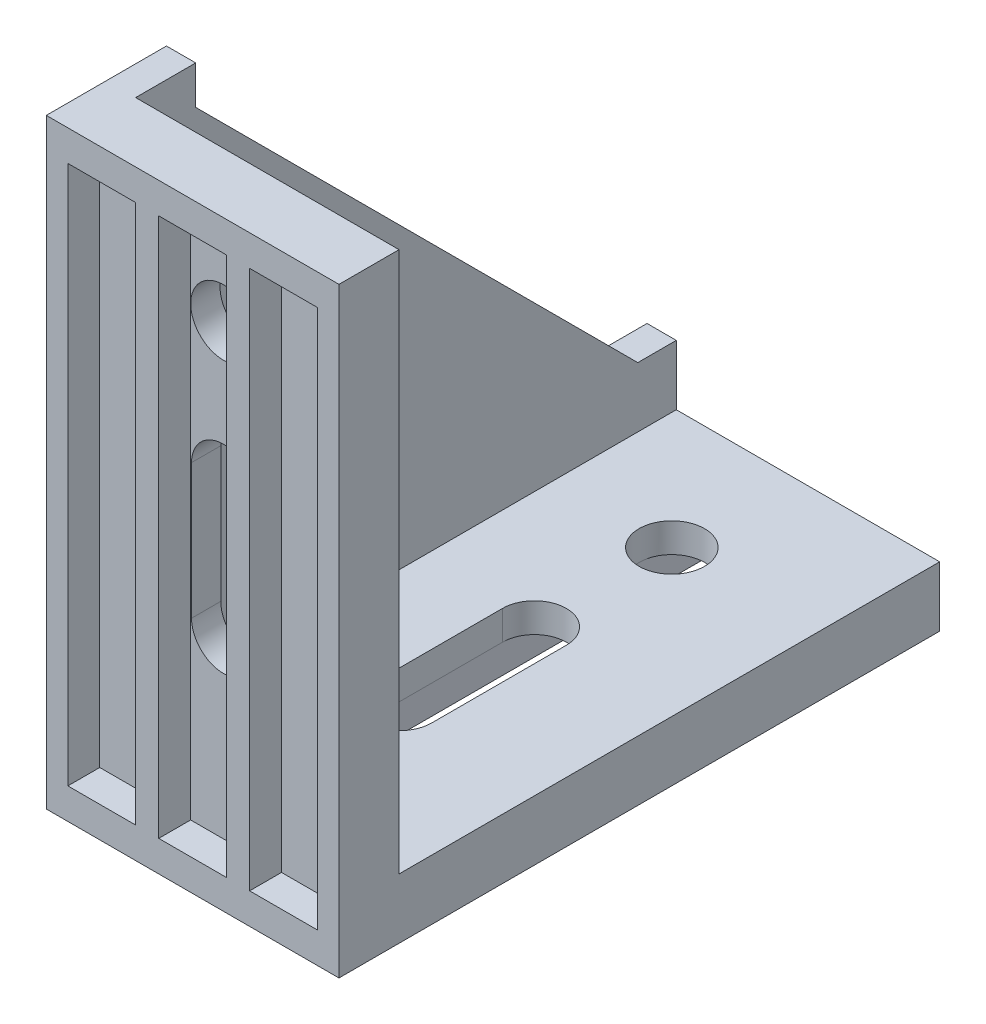
from build123d import *

# Parameters (mm, degrees)
SKETCH_1_W                    = 38
SKETCH_1_H                    = 78
EXTRUDE_1_DEPTH               = 7.8
SKETCH_3_W                    = 38
SKETCH_3_H                    = 7.8
EXTRUDE_2_DEPTH               = 78
EXTRUDE_3_DEPTH               = 3.8
SKETCH_5_R                    = 4.25
CUT_EXTRUDE_1_DEPTH           = 102.079572615
SKETCH_6_W                    = 8.8
SKETCH_6_H                    = 70
CUT_EXTRUDE_2_DEPTH           = 4
CUT_EXTRUDE_2_DRAFT           = -2
CUT_EXTRUDE_2_PROFILE_2_DEPTH = 4
CUT_EXTRUDE_2_PROFILE_2_DRAFT = -2
CUT_EXTRUDE_2_PROFILE_3_DEPTH = 4
CUT_EXTRUDE_2_PROFILE_3_DRAFT = -2
SKETCH_7_W                    = 8.8
SKETCH_7_H                    = 70
CUT_EXTRUDE_3_DEPTH           = 4
CUT_EXTRUDE_3_DRAFT           = -2
CUT_EXTRUDE_3_PROFILE_2_DEPTH = 4
CUT_EXTRUDE_3_PROFILE_2_DRAFT = -2
CUT_EXTRUDE_3_PROFILE_3_DEPTH = 4
CUT_EXTRUDE_3_PROFILE_3_DRAFT = -2


with BuildPart() as part:
    # 草图1 → 凸台-拉伸1 (new body)
    with BuildSketch(Plane.XY):
        Rectangle(SKETCH_1_W, SKETCH_1_H)
    extrude(amount=EXTRUDE_1_DEPTH)

    # 草图3 → 凸台-拉伸2 (add)
    with BuildSketch(Plane.XY.offset(7.8)):
        with Locations((0, -35.1)):
            Rectangle(SKETCH_3_W, SKETCH_3_H)
    extrude(amount=-EXTRUDE_2_DEPTH)

    # 草图4 → 凸台-拉伸3 (add)
    with BuildSketch(Plane.ZY.offset(19)):
        Polygon((0, 39), (-7.8, 39), (-7.8, 34), (-65.2, -23.4), (-70.2, -23.4), (-70.2, -31.2), (0, -31.2), align=None)
    extrude(amount=-EXTRUDE_3_DEPTH)

    # 草图5 → 切除-拉伸1 (cut, through all)
    with BuildSketch(Plane(origin=(0, -31.2, 0), x_dir=(1, 0, 0), z_dir=(0, 1, 0))):
        with Locations(Location((0, 54.416495981, 0), (0, 0, 270))):
            Circle(SKETCH_5_R)
        with BuildLine():
            Line((-4.1430597, 19.083232121), (-4.1430597, 36.583232121))
            ThreePointArc((-4.1430597, 36.583232121), (0, 40.726291822), (4.1430597, 36.583232121))
            Line((4.1430597, 36.583232121), (4.1430597, 19.083232121))
            ThreePointArc((4.1430597, 19.083232121), (0, 14.940172421), (-4.1430597, 19.083232121))
        make_face()
    cut_extrude_1 = extrude(amount=-CUT_EXTRUDE_1_DEPTH, mode=Mode.SUBTRACT)

    # 镜向1: 切除-拉伸1 across plane
    add(cut_extrude_1.mirror(Plane(origin=(0, -15.6, -15.6), x_dir=(0, -0.7071067811865478, 0.7071067811865474), z_dir=(0, 0.7071067811865472, 0.7071067811865478))), mode=Mode.SUBTRACT)


with BuildPart() as cut_extrude_2_tool:
    # 草图6 → 切除-拉伸2 (with draft: the straight prism first)
    with BuildSketch(Plane.XZ.offset(39)):
        with Locations((-11.8, -31.2)):
            Rectangle(SKETCH_6_W, SKETCH_6_H)
    extrude(amount=-CUT_EXTRUDE_2_DEPTH)
    # 切除-拉伸2: the draft: its side faces are tilted about the plane it starts from
    cut_extrude_2_sides = [cut_extrude_2_tool.faces().sort_by_distance(p)[0] for p in [
        (-16.2, -37, -31.2),
        (-11.8, -37, -66.2),
        (-7.4, -37, -31.2),
        (-11.8, -37, 3.8),
    ]]
    draft(cut_extrude_2_sides, Plane.XZ.offset(39), CUT_EXTRUDE_2_DRAFT)


with BuildPart() as part_1:
    add(part.part)

    # 切除-拉伸2: cut by cut_extrude_2_tool
    add(cut_extrude_2_tool.part, mode=Mode.SUBTRACT)


with BuildPart() as cut_extrude_2_profile_2_tool:
    # 草图6 → 切除-拉伸2 profile 2 (with draft: the straight prism first)
    with BuildSketch(Plane.XZ.offset(39)):
        with Locations((0, -31.2)):
            Rectangle(SKETCH_6_W, SKETCH_6_H)
    extrude(amount=-CUT_EXTRUDE_2_PROFILE_2_DEPTH)
    # 切除-拉伸2 profile 2: the draft: its side faces are tilted about the plane it starts from
    cut_extrude_2_profile_2_sides = [cut_extrude_2_profile_2_tool.faces().sort_by_distance(p)[0] for p in [
        (-4.4, -37, -31.2),
        (0, -37, -66.2),
        (4.4, -37, -31.2),
        (0, -37, 3.8),
    ]]
    draft(cut_extrude_2_profile_2_sides, Plane.XZ.offset(39), CUT_EXTRUDE_2_PROFILE_2_DRAFT)


with BuildPart() as part_2:
    add(part_1.part)

    # 切除-拉伸2 profile 2: cut by cut_extrude_2_profile_2_tool
    add(cut_extrude_2_profile_2_tool.part, mode=Mode.SUBTRACT)


with BuildPart() as cut_extrude_2_profile_3_tool:
    # 草图6 → 切除-拉伸2 profile 3 (with draft: the straight prism first)
    with BuildSketch(Plane.XZ.offset(39)):
        with Locations((11.8, -31.2)):
            Rectangle(SKETCH_6_W, SKETCH_6_H)
    extrude(amount=-CUT_EXTRUDE_2_PROFILE_3_DEPTH)
    # 切除-拉伸2 profile 3: the draft: its side faces are tilted about the plane it starts from
    cut_extrude_2_profile_3_sides = [cut_extrude_2_profile_3_tool.faces().sort_by_distance(p)[0] for p in [
        (7.4, -37, -31.2),
        (11.8, -37, -66.2),
        (16.2, -37, -31.2),
        (11.8, -37, 3.8),
    ]]
    draft(cut_extrude_2_profile_3_sides, Plane.XZ.offset(39), CUT_EXTRUDE_2_PROFILE_3_DRAFT)


with BuildPart() as part_3:
    add(part_2.part)

    # 切除-拉伸2 profile 3: cut by cut_extrude_2_profile_3_tool
    add(cut_extrude_2_profile_3_tool.part, mode=Mode.SUBTRACT)


with BuildPart() as cut_extrude_3_tool:
    # 草图7 → 切除-拉伸3 (with draft: the straight prism first)
    with BuildSketch(Plane.XY.offset(7.8)):
        Rectangle(SKETCH_7_W, SKETCH_7_H)
    extrude(amount=-CUT_EXTRUDE_3_DEPTH)
    # 切除-拉伸3: the draft: its side faces are tilted about the plane it starts from
    cut_extrude_3_sides = [cut_extrude_3_tool.faces().sort_by_distance(p)[0] for p in [
        (-4.4, 0, 5.8),
        (0, -35, 5.8),
        (4.4, 0, 5.8),
        (0, 35, 5.8),
    ]]
    draft(cut_extrude_3_sides, Plane.XY.offset(7.8), CUT_EXTRUDE_3_DRAFT)


with BuildPart() as part_4:
    add(part_3.part)

    # 切除-拉伸3: cut by cut_extrude_3_tool
    add(cut_extrude_3_tool.part, mode=Mode.SUBTRACT)


with BuildPart() as cut_extrude_3_profile_2_tool:
    # 草图7 → 切除-拉伸3 profile 2 (with draft: the straight prism first)
    with BuildSketch(Plane.XY.offset(7.8)):
        with Locations((-11.8, 0)):
            Rectangle(SKETCH_7_W, SKETCH_7_H)
    extrude(amount=-CUT_EXTRUDE_3_PROFILE_2_DEPTH)
    # 切除-拉伸3 profile 2: the draft: its side faces are tilted about the plane it starts from
    cut_extrude_3_profile_2_sides = [cut_extrude_3_profile_2_tool.faces().sort_by_distance(p)[0] for p in [
        (-16.2, 0, 5.8),
        (-11.8, -35, 5.8),
        (-7.4, 0, 5.8),
        (-11.8, 35, 5.8),
    ]]
    draft(cut_extrude_3_profile_2_sides, Plane.XY.offset(7.8), CUT_EXTRUDE_3_PROFILE_2_DRAFT)


with BuildPart() as part_5:
    add(part_4.part)

    # 切除-拉伸3 profile 2: cut by cut_extrude_3_profile_2_tool
    add(cut_extrude_3_profile_2_tool.part, mode=Mode.SUBTRACT)


with BuildPart() as cut_extrude_3_profile_3_tool:
    # 草图7 → 切除-拉伸3 profile 3 (with draft: the straight prism first)
    with BuildSketch(Plane.XY.offset(7.8)):
        with Locations((11.8, 0)):
            Rectangle(SKETCH_7_W, SKETCH_7_H)
    extrude(amount=-CUT_EXTRUDE_3_PROFILE_3_DEPTH)
    # 切除-拉伸3 profile 3: the draft: its side faces are tilted about the plane it starts from
    cut_extrude_3_profile_3_sides = [cut_extrude_3_profile_3_tool.faces().sort_by_distance(p)[0] for p in [
        (7.4, 0, 5.8),
        (11.8, -35, 5.8),
        (16.2, 0, 5.8),
        (11.8, 35, 5.8),
    ]]
    draft(cut_extrude_3_profile_3_sides, Plane.XY.offset(7.8), CUT_EXTRUDE_3_PROFILE_3_DRAFT)


with BuildPart() as part_6:
    add(part_5.part)

    # 切除-拉伸3 profile 3: cut by cut_extrude_3_profile_3_tool
    add(cut_extrude_3_profile_3_tool.part, mode=Mode.SUBTRACT)


solid = part_6.part
